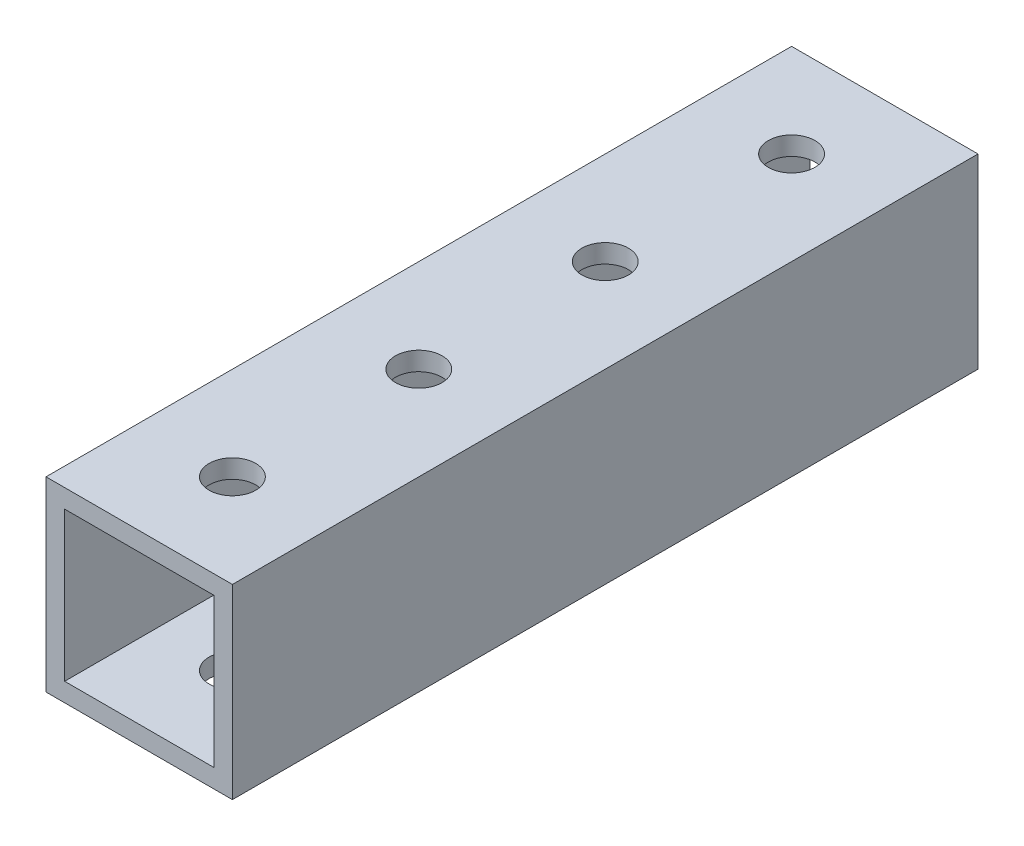
from build123d import *

# Parameters (mm, degrees)
SKETCH1_W           = 20
SKETCH1_H           = 20
SKETCH1_W_2         = 16
SKETCH1_H_2         = 16
BOSS_EXTRUDE1_DEPTH = 80
SKETCH2_R           = 2.5
CUT_EXTRUDE1_DEPTH  = 84.066238629


with BuildPart() as part:
    # Sketch1 → Boss-Extrude1 (new body)
    with BuildSketch(Plane.XY):
        Rectangle(SKETCH1_W, SKETCH1_H)
        Rectangle(SKETCH1_W_2, SKETCH1_H_2, mode=Mode.SUBTRACT)
    extrude(amount=BOSS_EXTRUDE1_DEPTH)

    # Sketch2 → Cut-Extrude1 (cut, through all)
    with BuildSketch(Plane(origin=(0, 10, 0), x_dir=(1, 0, 0), z_dir=(0, 1, 0))):
        with Locations(Location((0, -10, 0), (0, 0, 180))):
            Circle(SKETCH2_R)
        with Locations(Location((0, -30, 0), (0, 0, 180))):
            Circle(SKETCH2_R)
        with Locations(Location((0, -50, 0), (0, 0, 270))):
            Circle(SKETCH2_R)
        with Locations(Location((0, -70, 0), (0, 0, 270))):
            Circle(SKETCH2_R)
    extrude(amount=-CUT_EXTRUDE1_DEPTH, mode=Mode.SUBTRACT)


solid = part.part
